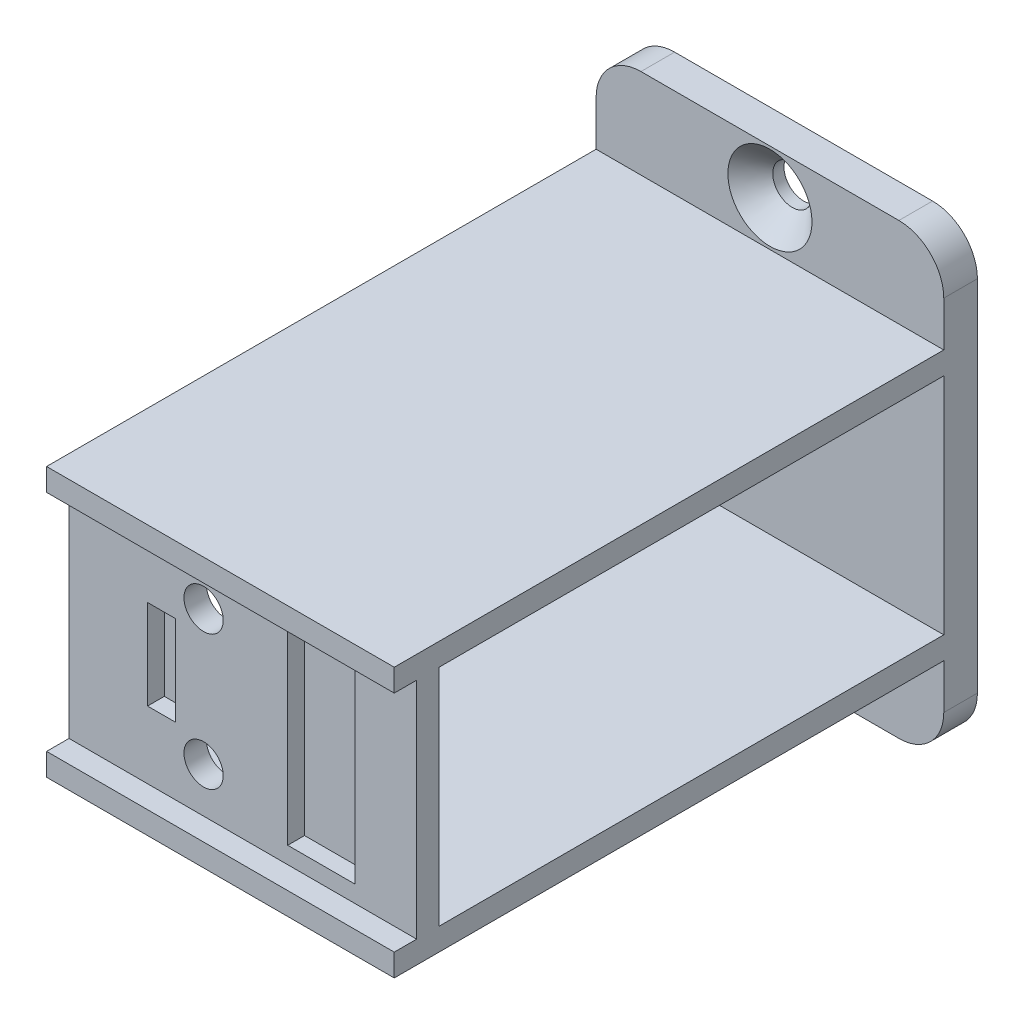
from build123d import *

# Parameters (mm, degrees)
SKETCH1_W           = 31
SKETCH1_H           = 24
BOSS_EXTRUDE1_DEPTH = 2
SKETCH2_W           = 31
SKETCH2_H           = 2
BOSS_EXTRUDE2_DEPTH = 2
SKETCH4_R           = 1.75
CUT_EXTRUDE1_DEPTH  = 3
SKETCH5_W           = 2.5
SKETCH5_H           = 8
SKETCH5_W_2         = 6
SKETCH5_H_2         = 17
CUT_EXTRUDE2_DEPTH  = 1.5
SKETCH6_W           = 31
SKETCH6_H           = 2
BOSS_EXTRUDE4_DEPTH = 48
BOSS_EXTRUDE5_START = 8
SKETCH8_W           = 31
SKETCH8_H           = 3
BOSS_EXTRUDE5_DEPTH = 40
SKETCH9_R           = 1.75
CUT_EXTRUDE3_DEPTH  = 38
CHAMFER1_SIZE       = 2
FILLET1_R           = 4
SKETCH10_R          = 1.5
CUT_EXTRUDE4_DEPTH  = 5


with BuildPart() as part:
    # Sketch1 → Boss-Extrude1 (new body)
    with BuildSketch(Plane.XY):
        with Locations((15.5, 12)):
            Rectangle(SKETCH1_W, SKETCH1_H)
    extrude(amount=BOSS_EXTRUDE1_DEPTH)

    # Sketch2 → Boss-Extrude2 (add)
    with BuildSketch(Plane.XY.offset(2)):
        with Locations((15.5, 23)):
            Rectangle(SKETCH2_W, SKETCH2_H)
        with Locations((15.5, 1)):
            Rectangle(SKETCH2_W, SKETCH2_H)
    extrude(amount=BOSS_EXTRUDE2_DEPTH)

    # Sketch4 → Cut-Extrude1 (cut)
    with BuildSketch(Plane.XY.offset(2)):
        with Locations((12, 18)):
            Circle(SKETCH4_R)
        with Locations((12, 6)):
            Circle(SKETCH4_R)
    extrude(amount=-CUT_EXTRUDE1_DEPTH, mode=Mode.SUBTRACT)

    # Sketch5 → Cut-Extrude2 (cut)
    with BuildSketch(Plane.XY.offset(2)):
        with Locations((8.25, 12)):
            Rectangle(SKETCH5_W, SKETCH5_H)
        with Locations((22.5, 12)):
            Rectangle(SKETCH5_W_2, SKETCH5_H_2)
    extrude(amount=-CUT_EXTRUDE2_DEPTH, mode=Mode.SUBTRACT)

    # Sketch6 → Boss-Extrude4 (add)
    with BuildSketch(Plane(origin=(0, 0, 0), x_dir=(-1, 0, 0), z_dir=(0, 0, -1))):
        with Locations((-15.5, 23)):
            Rectangle(SKETCH6_W, SKETCH6_H)
        with Locations((-15.5, 1)):
            Rectangle(SKETCH6_W, SKETCH6_H)
    extrude(amount=BOSS_EXTRUDE4_DEPTH)

    # Sketch8 → Boss-Extrude5 (add)
    with BuildSketch(Plane.XZ.offset(BOSS_EXTRUDE5_START)):
        with Locations((15.5, -46.5)):
            Rectangle(SKETCH8_W, SKETCH8_H)
    extrude(amount=-BOSS_EXTRUDE5_DEPTH)

    # Sketch9 → Cut-Extrude3 (cut)
    with BuildSketch(Plane.XY.offset(-45)):
        with Locations((15.5, 28)):
            Circle(SKETCH9_R)
        with Locations((15.5, -4)):
            Circle(SKETCH9_R)
    extrude(amount=-CUT_EXTRUDE3_DEPTH, mode=Mode.SUBTRACT)

    # Chamfer1
    chamfer1_edges = [part.edges().sort_by_distance(p)[0] for p in [
        (13.75, 28, -45),
        (13.75, -4, -45),
    ]]
    chamfer(chamfer1_edges, length=CHAMFER1_SIZE)

    # Fillet1
    fillet1_edges = [part.edges().sort_by_distance(p)[0] for p in [
        (0, 32, -46.5),
        (31, 32, -46.5),
        (0, -8, -46.5),
        (31, -8, -46.5),
    ]]
    fillet(fillet1_edges, radius=FILLET1_R)

    # Sketch10 → Cut-Extrude4 (cut)
    with BuildSketch(Plane.XZ):
        with Locations(Location((5, -10, 0), (0, 0, 270))):
            Circle(SKETCH10_R)
        with Locations(Location((5, -35, 0), (0, 0, 270))):
            Circle(SKETCH10_R)
    extrude(amount=-CUT_EXTRUDE4_DEPTH, mode=Mode.SUBTRACT)


solid = part.part
